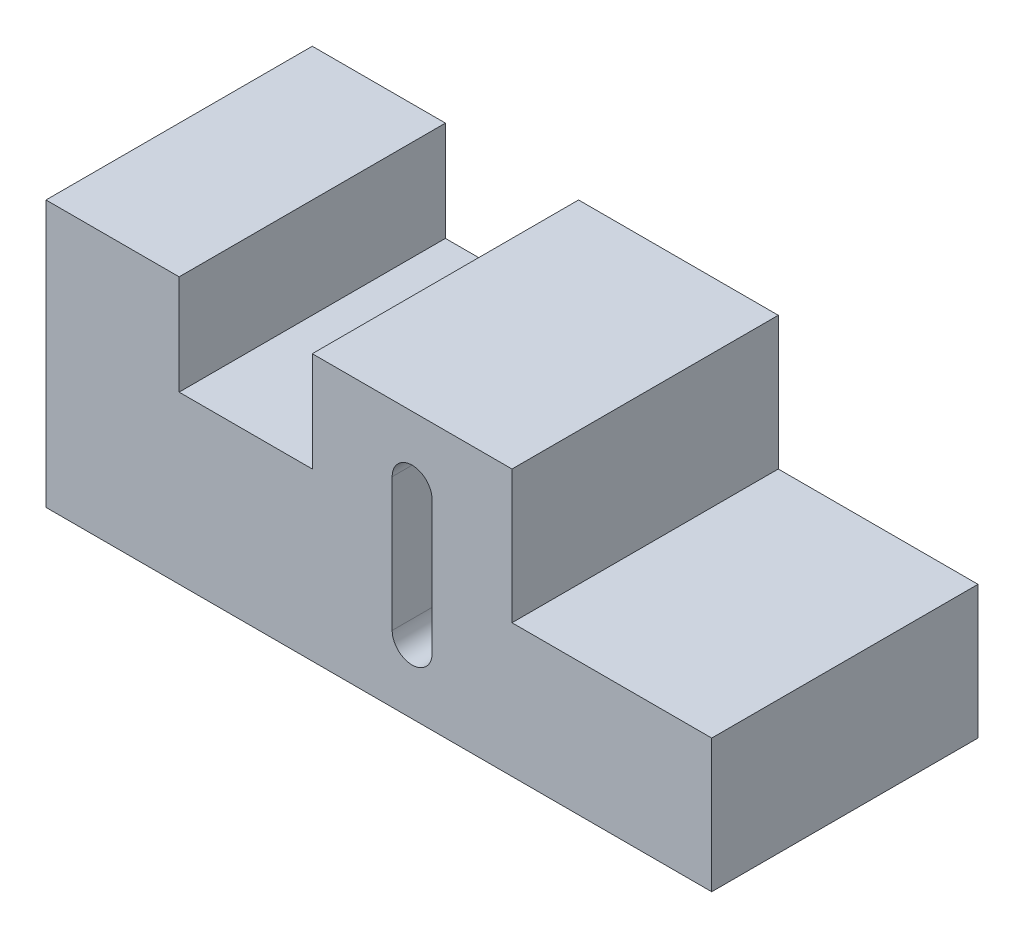
from build123d import *

# Parameters (mm, degrees)
BOSS_EXTRUDE1_DEPTH = 25.4


with BuildPart() as part:
    # Sketch1 → Boss-Extrude1 (new body)
    with BuildSketch(Plane.XY):
        Polygon((12.7, 25.4), (0, 25.4), (0, 0), (63.5, 0), (63.5, 12.7), (44.45, 12.7), (44.45, 25.4), (25.4, 25.4), (25.4, 15.875), (12.7, 15.875), align=None)
        with BuildLine():
            Line((36.83, 19.05), (36.83, 6.35))
            ThreePointArc((36.83, 6.35), (34.925, 4.445), (33.02, 6.35))
            Line((33.02, 6.35), (33.02, 19.05))
            ThreePointArc((33.02, 19.05), (34.925, 20.955), (36.83, 19.05))
        make_face(mode=Mode.SUBTRACT)
    extrude(amount=-BOSS_EXTRUDE1_DEPTH)


solid = part.part
